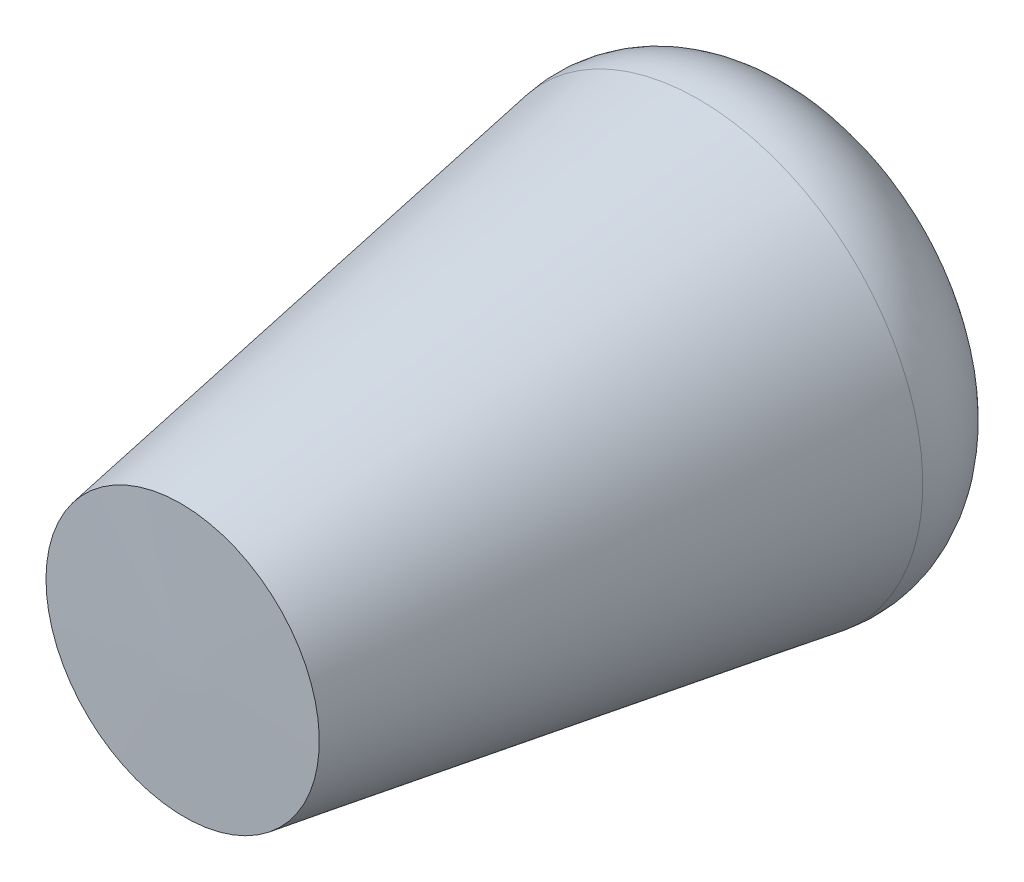
from build123d import *


with BuildPart() as part:
    # Sketch1 → Revolve1 (revolve)
    with BuildSketch(Plane(origin=(0, 0, 0), x_dir=(0, 0, -1), z_dir=(1, 0, 0))):
        with BuildLine():
            Line((0, 0), (0, 4.35))
            Line((0, 4.35), (16.480575626, 7.25597014))
            ThreePointArc((16.480575626, 7.25597014), (18.98210111, 6.554833169), (19.998361915, 4.163926066))
            Line((19.998361915, 4.163926066), (19.998361915, 0.25597014))
            Line((19.998361915, 0.25597014), (0, 0))
        make_face()
    revolve(axis=Axis((0, 0.25597014, -19.998361915), (0, -0.012798507023283388, 0.9999180957548348)))


solid = part.part
